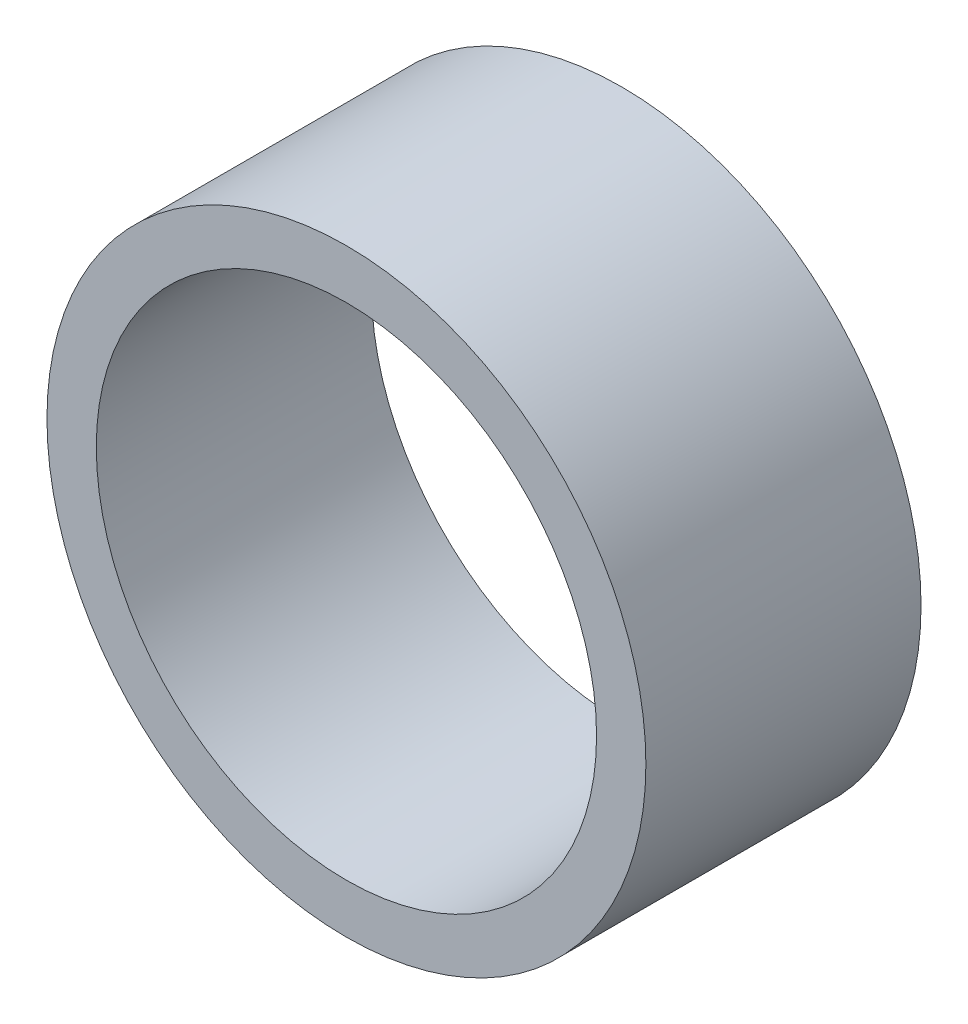
from build123d import *

# Parameters (mm, degrees)
ESQUISSE1_R      = 10.775
ESQUISSE1_R_2    = 9
EXTRUSION1_DEPTH = 9.9


with BuildPart() as part:
    # Esquisse1 → Extrusion1 (new body)
    with BuildSketch(Plane.XY):
        with Locations(Location((0, 0, 0), (0, 0, 180))):
            Circle(ESQUISSE1_R)
        with Locations(Location((0, 0, 0), (0, 0, 180))):
            Circle(ESQUISSE1_R_2, mode=Mode.SUBTRACT)
    extrude(amount=EXTRUSION1_DEPTH)


solid = part.part
